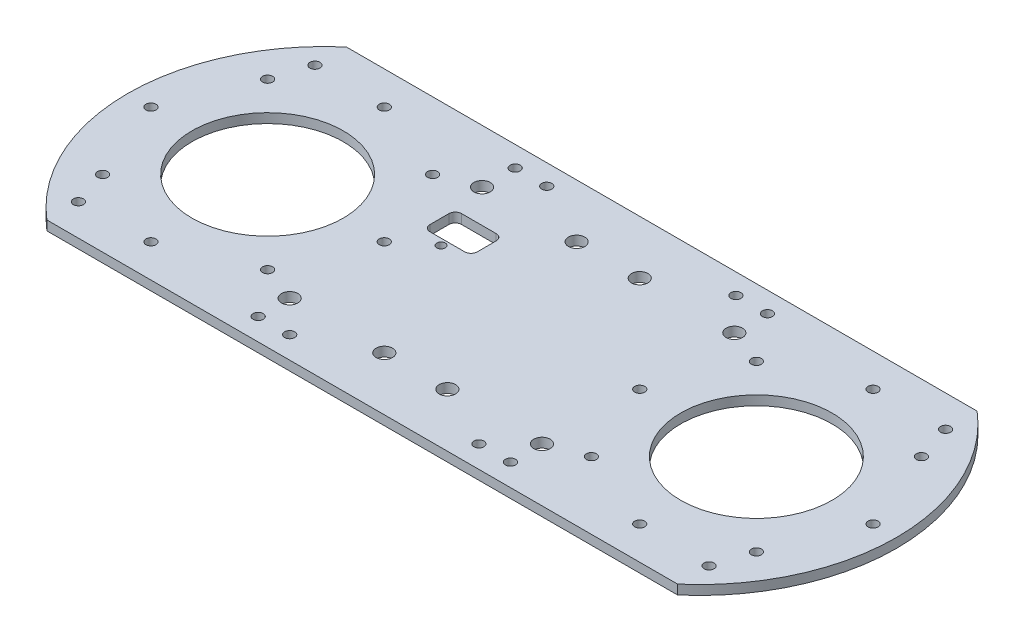
from build123d import *

# Parameters (mm, degrees)
SKETCH_1_R          = 18
SKETCH_1_R_2        = 1.6
SKETCH_1_R_3        = 2.6
SKETCH_1_R_4        = 1.35
EXTRUDE_1_DEPTH     = 3
CUT_EXTRUDE_1_REACH = 132.882
SKETCH_2_R          = 24


with BuildPart() as part:
    # 草图1 → 凸台-拉伸1 (new body)
    with BuildSketch(Plane(origin=(0, 0, 0), x_dir=(1, 0, 0), z_dir=(0, 1, 0))):
        with BuildLine():
            Line((100, -47.5), (-100, -47.5))
            ThreePointArc((-100, -47.5), (-121.921951267, 0), (-100, 47.5))
            Line((-100, 47.5), (100, 47.5))
            ThreePointArc((100, 47.5), (121.921951267, 0), (100, -47.5))
        make_face()
        with Locations(Location((77.5, 0, 0), (0, 0, 270))):
            Circle(SKETCH_1_R, mode=Mode.SUBTRACT)
        with Locations(Location((77.5, 37, 0), (0, 0, 270))):
            Circle(SKETCH_1_R_2, mode=Mode.SUBTRACT)
        with Locations(Location((103.662950904, 26.162950904, 0), (0, 0, 270))):
            Circle(SKETCH_1_R_2, mode=Mode.SUBTRACT)
        with Locations(Location((114.5, 0, 0), (0, 0, 270))):
            Circle(SKETCH_1_R_2, mode=Mode.SUBTRACT)
        with Locations(Location((103.662950904, -26.162950904, 0), (0, 0, 270))):
            Circle(SKETCH_1_R_2, mode=Mode.SUBTRACT)
        with Locations(Location((77.5, -37, 0), (0, 0, 270))):
            Circle(SKETCH_1_R_2, mode=Mode.SUBTRACT)
        with Locations(Location((51.337049096, -26.162950904, 0), (0, 0, 270))):
            Circle(SKETCH_1_R_2, mode=Mode.SUBTRACT)
        with Locations(Location((40.5, 0, 0), (0, 0, 270))):
            Circle(SKETCH_1_R_2, mode=Mode.SUBTRACT)
        with Locations(Location((51.337049096, 26.162950904, 0), (0, 0, 270))):
            Circle(SKETCH_1_R_2, mode=Mode.SUBTRACT)
        with Locations(Location((-51.337049096, 26.162950904, 0), (0, 0, 270))):
            Circle(SKETCH_1_R_2, mode=Mode.SUBTRACT)
        with Locations(Location((-40.5, 0, 0), (0, 0, 270))):
            Circle(SKETCH_1_R_2, mode=Mode.SUBTRACT)
        with Locations(Location((-51.337049096, -26.162950904, 0), (0, 0, 270))):
            Circle(SKETCH_1_R_2, mode=Mode.SUBTRACT)
        with Locations(Location((-77.5, -37, 0), (0, 0, 270))):
            Circle(SKETCH_1_R_2, mode=Mode.SUBTRACT)
        with Locations(Location((-103.662950904, -26.162950904, 0), (0, 0, 270))):
            Circle(SKETCH_1_R_2, mode=Mode.SUBTRACT)
        with Locations(Location((-114.5, 0, 0), (0, 0, 270))):
            Circle(SKETCH_1_R_2, mode=Mode.SUBTRACT)
        with Locations(Location((-103.662950904, 26.162950904, 0), (0, 0, 270))):
            Circle(SKETCH_1_R_2, mode=Mode.SUBTRACT)
        with Locations(Location((-77.5, 37, 0), (0, 0, 270))):
            Circle(SKETCH_1_R_2, mode=Mode.SUBTRACT)
        with Locations(Location((-77.5, 0, 0), (0, 0, 270))):
            Circle(SKETCH_1_R, mode=Mode.SUBTRACT)
        with Locations(Location((-10, -30.5, 0), (0, 0, 270))):
            Circle(SKETCH_1_R_3, mode=Mode.SUBTRACT)
        with Locations(Location((10, -30.5, 0), (0, 0, 270))):
            Circle(SKETCH_1_R_3, mode=Mode.SUBTRACT)
        with Locations(Location((-40, -30.5, 0), (0, 0, 270))):
            Circle(SKETCH_1_R_3, mode=Mode.SUBTRACT)
        with Locations(Location((40, -30.5, 0), (0, 0, 270))):
            Circle(SKETCH_1_R_3, mode=Mode.SUBTRACT)
        with Locations(Location((40, 30.5, 0), (0, 0, 270))):
            Circle(SKETCH_1_R_3, mode=Mode.SUBTRACT)
        with Locations(Location((10, 30.5, 0), (0, 0, 270))):
            Circle(SKETCH_1_R_3, mode=Mode.SUBTRACT)
        with Locations(Location((-10, 30.5, 0), (0, 0, 270))):
            Circle(SKETCH_1_R_3, mode=Mode.SUBTRACT)
        with Locations(Location((-40, 30.5, 0), (0, 0, 270))):
            Circle(SKETCH_1_R_3, mode=Mode.SUBTRACT)
        with Locations(Location((-30, -40.5, 0), (0, 0, 270))):
            Circle(SKETCH_1_R_2, mode=Mode.SUBTRACT)
        with Locations(Location((-40, -40.5, 0), (0, 0, 270))):
            Circle(SKETCH_1_R_2, mode=Mode.SUBTRACT)
        with Locations(Location((40, -40.5, 0), (0, 0, 270))):
            Circle(SKETCH_1_R_2, mode=Mode.SUBTRACT)
        with Locations(Location((30, -40.5, 0), (0, 0, 270))):
            Circle(SKETCH_1_R_2, mode=Mode.SUBTRACT)
        with Locations(Location((-40, 41, 0), (0, 0, 270))):
            Circle(SKETCH_1_R_2, mode=Mode.SUBTRACT)
        with Locations(Location((-30, 41, 0), (0, 0, 270))):
            Circle(SKETCH_1_R_2, mode=Mode.SUBTRACT)
        with Locations(Location((30, 41, 0), (0, 0, 270))):
            Circle(SKETCH_1_R_2, mode=Mode.SUBTRACT)
        with Locations(Location((40, 41, 0), (0, 0, 270))):
            Circle(SKETCH_1_R_2, mode=Mode.SUBTRACT)
        with Locations(Location((100, 37.5, 0), (0, 0, 270))):
            Circle(SKETCH_1_R_2, mode=Mode.SUBTRACT)
        with Locations(Location((100, -37.5, 0), (0, 0, 270))):
            Circle(SKETCH_1_R_2, mode=Mode.SUBTRACT)
        with Locations(Location((-100, -37.5, 0), (0, 0, 270))):
            Circle(SKETCH_1_R_2, mode=Mode.SUBTRACT)
        with Locations(Location((-100, 37.5, 0), (0, 0, 270))):
            Circle(SKETCH_1_R_2, mode=Mode.SUBTRACT)
        with Locations(Location((-30.5, 8, 0), (0, 0, 270))):
            Circle(SKETCH_1_R_4, mode=Mode.SUBTRACT)
        with BuildLine():
            Line((-36, 20), (-25, 20))
            ThreePointArc((-25, 20), (-23.585786438, 19.414213562), (-23, 18))
            Line((-23, 18), (-23, 12))
            ThreePointArc((-23, 12), (-23.585786438, 10.585786438), (-25, 10))
            Line((-25, 10), (-36, 10))
            ThreePointArc((-36, 10), (-37.414213562, 10.585786438), (-38, 12))
            Line((-38, 12), (-38, 18))
            ThreePointArc((-38, 18), (-37.414213562, 19.414213562), (-36, 20))
        make_face(mode=Mode.SUBTRACT)
    extrude(amount=EXTRUDE_1_DEPTH)

    # 草图2 → 切除-拉伸1 (cut, up to next)
    with BuildSketch(Plane(origin=(0, 3, 0), x_dir=(1, 0, 0), z_dir=(0, 1, 0)), mode=Mode.PRIVATE) as cut_extrude_1_sk1:
        with Locations(Location((77.5, 0, 0), (0, 0, 270))):
            Circle(SKETCH_2_R)
    cut_extrude_1_tool1 = extrude(cut_extrude_1_sk1.sketch, amount=-CUT_EXTRUDE_1_REACH, mode=Mode.PRIVATE) & part.part
    # 草图2 → 切除-拉伸1 (cut, up to next)
    with BuildSketch(Plane(origin=(0, 3, 0), x_dir=(1, 0, 0), z_dir=(0, 1, 0)), mode=Mode.PRIVATE) as cut_extrude_1_sk2:
        with Locations(Location((-77.5, 0, 0), (0, 0, 270))):
            Circle(SKETCH_2_R)
    cut_extrude_1_tool2 = extrude(cut_extrude_1_sk2.sketch, amount=-CUT_EXTRUDE_1_REACH, mode=Mode.PRIVATE) & part.part
    add(cut_extrude_1_tool1.solids().sort_by_distance((77.5, 3, 0))[0], mode=Mode.SUBTRACT)
    add(cut_extrude_1_tool2.solids().sort_by_distance((-77.5, 3, 0))[0], mode=Mode.SUBTRACT)


solid = part.part
